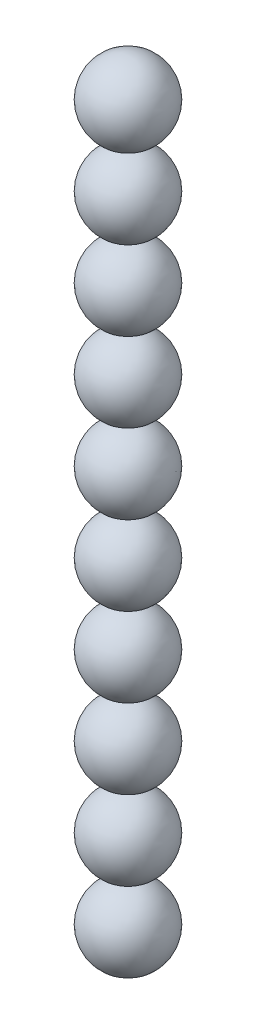
from build123d import *


with BuildPart() as part:
    # Sketch1 → Revolve6 (revolve)
    with BuildSketch(Plane.XY):
        with BuildLine():
            Line((0, 3), (0, -3))
            ThreePointArc((0, -3), (3, 0), (0, 3))
        make_face()
        with BuildLine():
            Line((0, 9.254), (0, 3.254))
            ThreePointArc((0, 3.254), (3, 6.254), (0, 9.254))
        make_face()
        with BuildLine():
            Line((0, 15.508), (0, 9.508))
            ThreePointArc((0, 9.508), (3, 12.508), (0, 15.508))
        make_face()
        with BuildLine():
            Line((0, 21.762), (0, 15.762))
            ThreePointArc((0, 15.762), (3, 18.762), (0, 21.762))
        make_face()
        with BuildLine():
            Line((0, 28.016), (0, 22.016))
            ThreePointArc((0, 22.016), (3, 25.016), (0, 28.016))
        make_face()
        with BuildLine():
            Line((0, 34.27), (0, 28.27))
            ThreePointArc((0, 28.27), (3, 31.27), (0, 34.27))
        make_face()
        with BuildLine():
            Line((0, 40.524), (0, 34.524))
            ThreePointArc((0, 34.524), (3, 37.524), (0, 40.524))
        make_face()
        with BuildLine():
            Line((0, 46.778), (0, 40.778))
            ThreePointArc((0, 40.778), (3, 43.778), (0, 46.778))
        make_face()
        with BuildLine():
            Line((0, 53.032), (0, 47.032))
            ThreePointArc((0, 47.032), (3, 50.032), (0, 53.032))
        make_face()
        with BuildLine():
            Line((0, 59.286), (0, 53.286))
            ThreePointArc((0, 53.286), (3, 56.286), (0, 59.286))
        make_face()
    revolve(axis=Axis((0, 3, 0), (0, -1, 0)))


solid = part.part
